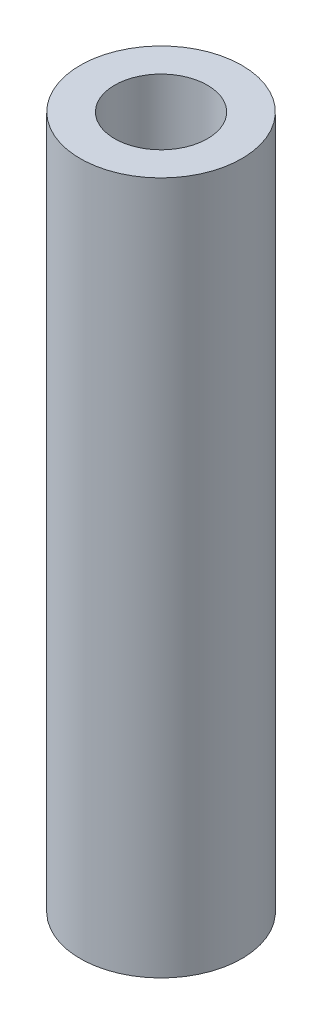
from build123d import *

# Parameters (mm, degrees)
SKETCH1_R           = 4.445
SKETCH1_R_2         = 2.5527
BOSS_EXTRUDE1_DEPTH = 38.1


with BuildPart() as part:
    # Sketch1 → Boss-Extrude1 (new body)
    with BuildSketch(Plane(origin=(0, 0, 0), x_dir=(1, 0, 0), z_dir=(0, 1, 0))):
        with Locations(Location((0, 0, 0), (0, 0, 90))):
            Circle(SKETCH1_R)
        with Locations(Location((0, 0, 0), (0, 0, 90))):
            Circle(SKETCH1_R_2, mode=Mode.SUBTRACT)
    extrude(amount=BOSS_EXTRUDE1_DEPTH)


solid = part.part
